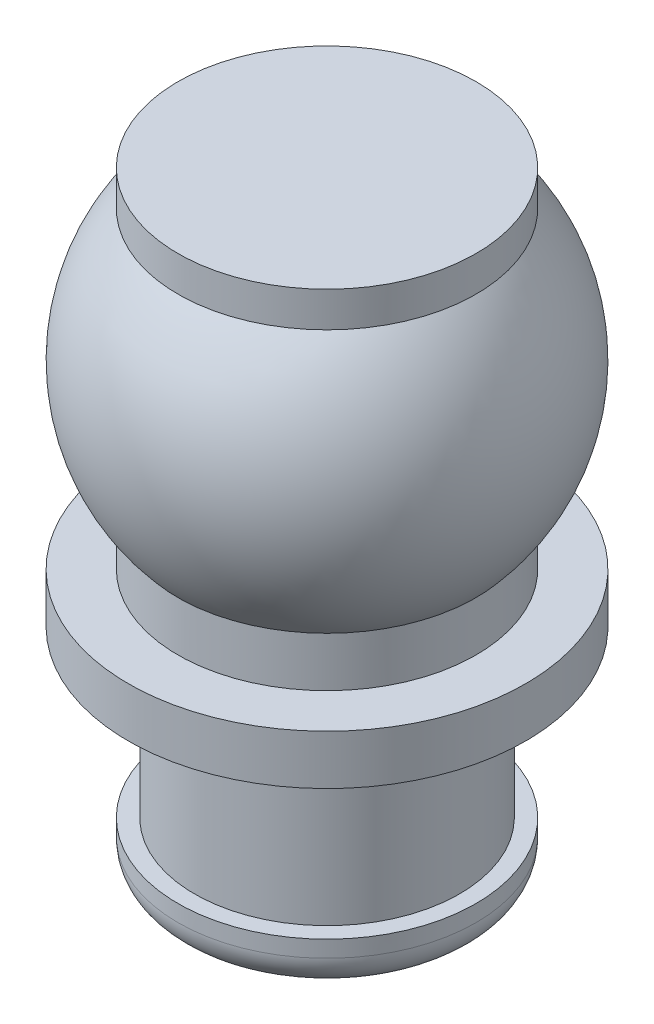
from build123d import *

# Parameters (mm, degrees)
CONG_1_R = 1


with BuildPart() as part:
    # Esquisse1 → Révolution1 (revolve)
    with BuildSketch(Plane.XY, mode=Mode.PRIVATE) as r_volution1_sk:
        with BuildLine():
            Line((-4.5, 39.289558898), (-4.5, 37.789558898))
            Line((-4.5, 37.789558898), (-6, 37.789558898))
            Line((-6, 37.789558898), (-6, 36.289558898))
            Line((-6, 36.289558898), (-4, 36.289558898))
            Line((-4, 36.289558898), (-4, 31.289558898))
            Line((-4, 31.289558898), (-4.5, 31.289558898))
            Line((-4.5, 31.289558898), (-4.5, 29.789558898))
            Line((-4.5, 29.789558898), (0, 29.789558898))
            Line((0, 29.789558898), (0, 48.289558898))
            Line((0, 48.289558898), (-4.5, 48.289558898))
            Line((-4.5, 48.289558898), (-4.5, 47.226812831))
            ThreePointArc((-4.5, 47.226812831), (-6, 43.258185864), (-4.5, 39.289558898))
        make_face()
    revolve(r_volution1_sk.sketch.rotate(Axis((0, 0, 0), (0, 1, 0)), 270), axis=Axis((0, 0, 0), (0, 1, 0)))

    # Congé1
    cong_1_edges = [part.edges().sort_by_distance(p)[0] for p in [
        (0, 29.789558898, 4.5),
    ]]
    fillet(cong_1_edges, radius=CONG_1_R)


solid = part.part
